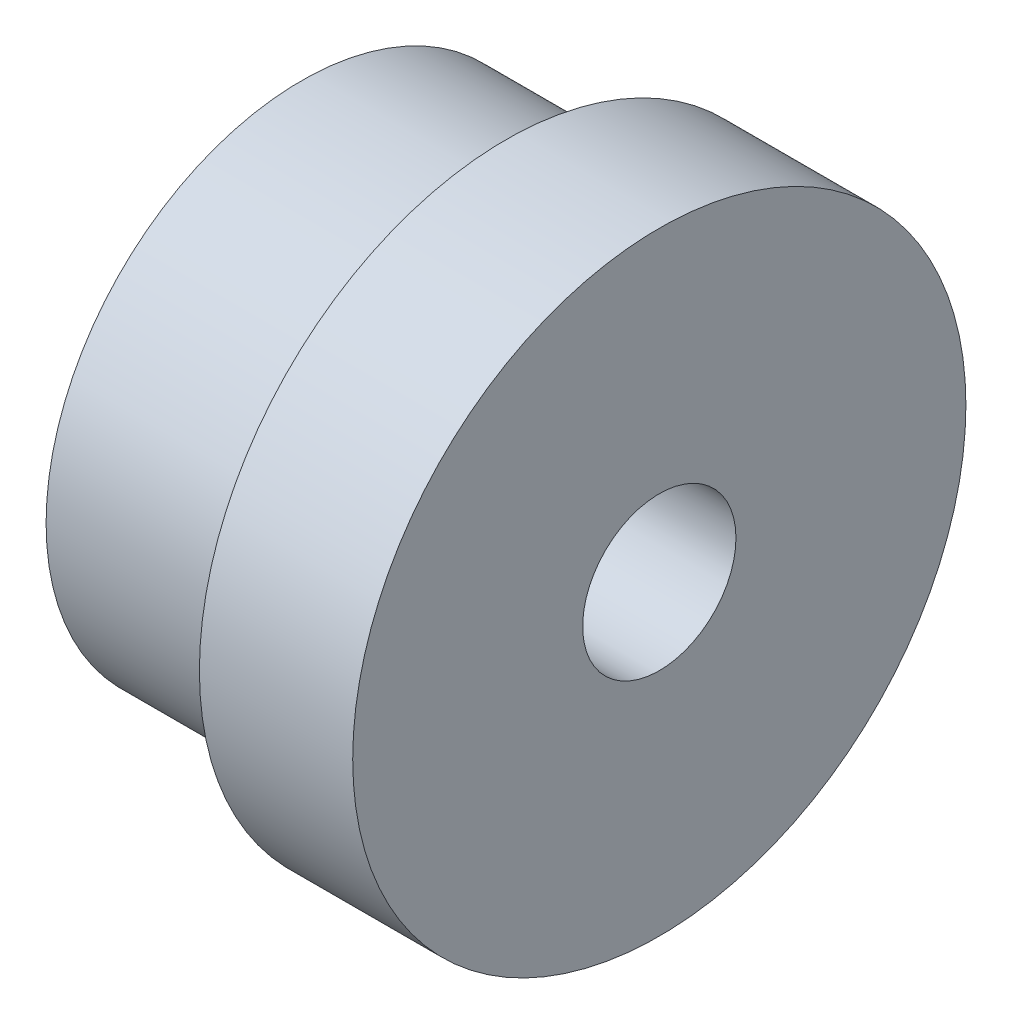
from build123d import *

# Parameters (mm, degrees)
SKETCH1_R             = 9.525
BOSS_EXTRUDE1_DEPTH   = 4.7625
SKETCH2_R             = 7.9375
BOSS_EXTRUDE2_DEPTH   = 6.35
F_4_CLEARANCE_HOLE1_D = 4.7625


with BuildPart() as part:
    # Sketch1 → Boss-Extrude1 (new body)
    with BuildSketch(Plane(origin=(0, 0, 0), x_dir=(0, 0, -1), z_dir=(1, 0, 0))):
        with Locations(Location((0, 0, 0), (0, 0, 180))):
            Circle(SKETCH1_R)
    extrude(amount=BOSS_EXTRUDE1_DEPTH)

    # Sketch2 → Boss-Extrude2 (add)
    with BuildSketch(Plane.ZY):
        with Locations(Location((0, 0, 0), (0, 0, 180))):
            Circle(SKETCH2_R)
    extrude(amount=BOSS_EXTRUDE2_DEPTH)

    # #4 Clearance Hole1 (through all)
    with Locations(Plane(origin=(4.7625, 0, 0), x_dir=(0, 0, -1), z_dir=(1, 0, 0))):
        with Locations((0, 0)):
            Hole(F_4_CLEARANCE_HOLE1_D / 2)


solid = part.part
